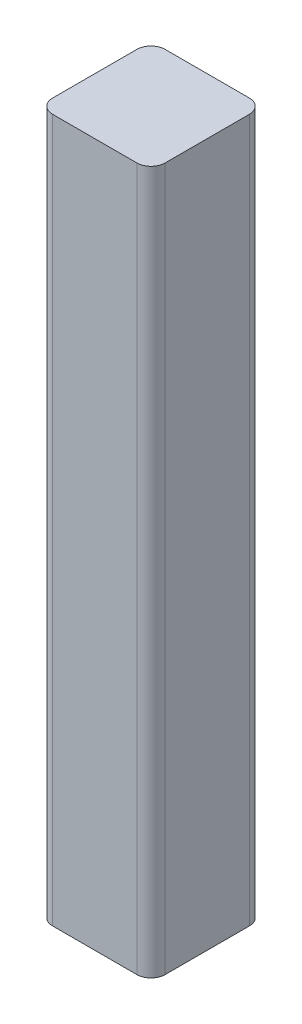
from build123d import *

# Parameters (mm, degrees)
SKETCH1_W           = 40
SKETCH1_H           = 40
BOSS_EXTRUDE1_DEPTH = 250
FILLET1_R           = 5


with BuildPart() as part:
    # Sketch1 → Boss-Extrude1 (new body)
    with BuildSketch(Plane(origin=(0, 0, 0), x_dir=(1, 0, 0), z_dir=(0, 1, 0))):
        Rectangle(SKETCH1_W, SKETCH1_H)
    extrude(amount=BOSS_EXTRUDE1_DEPTH)

    # Fillet1
    fillet1_edges = [part.edges().sort_by_distance(p)[0] for p in [
        (20, 125, 20),
        (-20, 125, 20),
        (-20, 125, -20),
        (20, 125, -20),
    ]]
    fillet(fillet1_edges, radius=FILLET1_R)


solid = part.part
